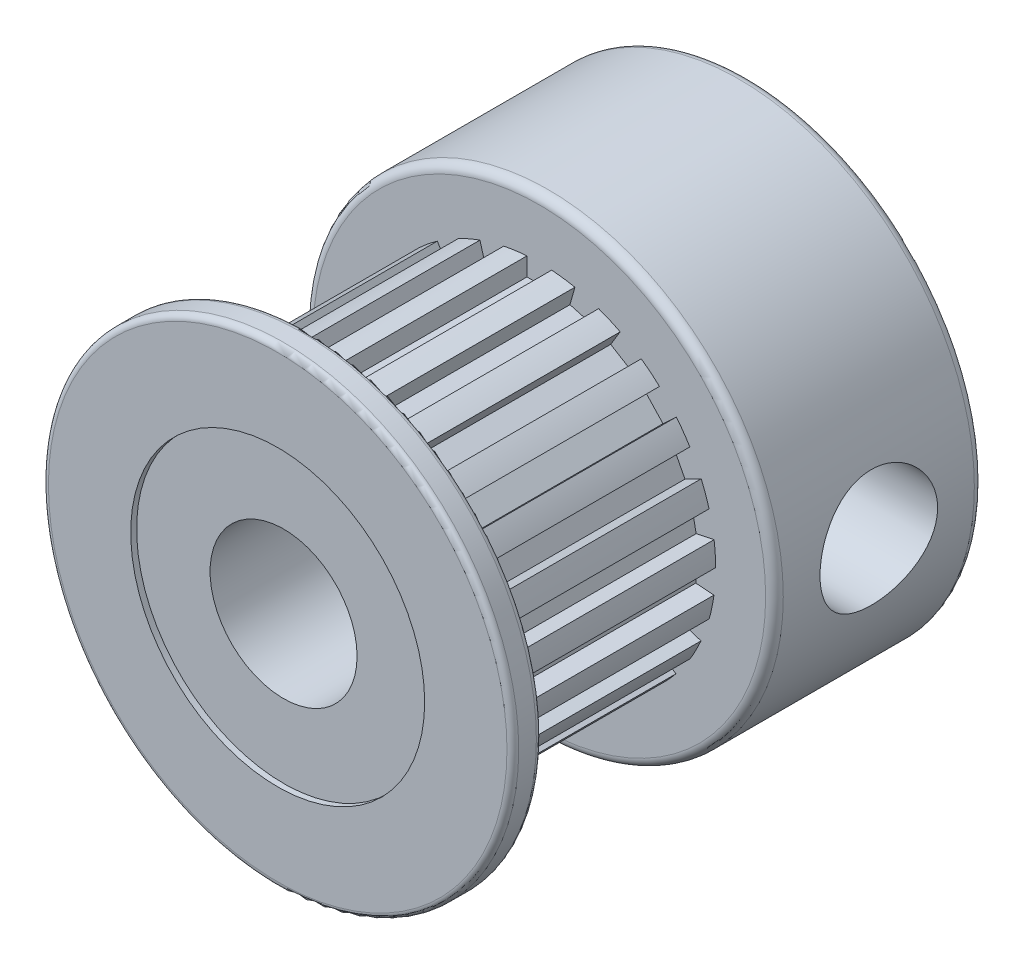
from build123d import *

# Parameters (mm, degrees)
SKETCH_1_R               = 8
EXTRUDE_1_DEPTH          = 7.1
SKETCH_2_R               = 6
EXTRUDE_2_DEPTH          = 7.9
SKETCH_3_R               = 8
EXTRUDE_3_DEPTH          = 1
SKETCH_4_W               = 0.839391048
SKETCH_4_H               = 1.04923881
CUT_EXTRUDE_1_DEPTH      = 7.9
SKETCH_5_R               = 2.5
CUT_EXTRUDE_2_DEPTH      = 21
CUT_EXTRUDE_3_REACH      = 26
CUT_EXTRUDE_3_END_RADIUS = 2.5
SKETCH_6_R               = 2
CUT_EXTRUDE_4_REACH      = 26
CUT_EXTRUDE_4_END_RADIUS = 2.5
SKETCH_7_R               = 2
SKETCH_8_R               = 5
CUT_EXTRUDE_5_DEPTH      = 0.2
FILLET_1_R               = 0.2
FILLET_2_R               = 0.3


with BuildPart() as part:
    # 草图1 → 凸台-拉伸1 (new body)
    with BuildSketch(Plane.XY):
        Circle(SKETCH_1_R)
    extrude(amount=EXTRUDE_1_DEPTH)

    # 草图2 → 凸台-拉伸2 (add)
    with BuildSketch(Plane.XY.offset(7.1)):
        Circle(SKETCH_2_R)
    extrude(amount=EXTRUDE_2_DEPTH)

    # 草图3 → 凸台-拉伸3 (add)
    with BuildSketch(Plane.XY.offset(15)):
        Circle(SKETCH_3_R)
    extrude(amount=EXTRUDE_3_DEPTH)

    # 草图4 → 切除-拉伸1 (cut)
    with BuildSketch(Plane.XY.offset(7.1)):
        Polygon((1.326202023, 6.288875776), (1.04312078, 5.278545587), (1.851384931, 5.052080593), (2.134466174, 6.062410781), align=None)
        with Locations((0, 5.888852821)):
            Rectangle(SKETCH_4_W, SKETCH_4_H)
        Polygon((2.973741233, 5.697862179), (2.428573588, 4.80137218), (3.145765587, 4.365238063), (3.690933233, 5.261728063), align=None)
        Polygon((4.40073166, 4.68426421), (3.633910202, 3.968102962), (4.206839201, 3.354645796), (4.973660658, 4.070807044), align=None)
        Polygon((5.501339951, 3.323255794), (4.569736321, 2.840537701), (4.955910795, 2.095254797), (5.887514425, 2.57797289), align=None)
        Polygon((6.193939026, 1.715776698), (5.166646002, 1.502302753), (5.337425159, 0.680468335), (6.364718182, 0.89394228), align=None)
        Polygon((6.427161978, -0.018953706), (5.380369186, 0.052648883), (5.323087115, -0.784785351), (6.369879907, -0.85638794), align=None)
        Polygon((6.183711728, -1.7522784), (5.195055, -1.400909715), (4.913960051, -2.191835098), (5.90261678, -2.543203783), align=None)
        Polygon((5.481643869, -3.355644622), (4.62444735, -2.750569247), (4.14038705, -3.436326462), (4.997583569, -4.041401837), align=None)
        Polygon((4.37302756, -4.710138033), (3.710865596, -3.896231641), (3.059740483, -4.425961212), (3.721902447, -5.239867604), align=None)
        Polygon((2.940083802, -5.715302054), (2.522065917, -4.752928359), (1.752166961, -5.087342668), (2.170184847, -6.049716362), align=None)
        Polygon((1.289087479, -6.296588267), (1.146216147, -5.257122124), (0.314643232, -5.37141919), (0.457514565, -6.410885333), align=None)
        Polygon((-0.457514565, -6.410885333), (-0.314643232, -5.37141919), (-1.146216147, -5.257122124), (-1.289087479, -6.296588267), align=None)
        Polygon((-2.170184847, -6.049716362), (-1.752166961, -5.087342668), (-2.522065917, -4.752928359), (-2.940083802, -5.715302054), align=None)
        Polygon((-3.721902447, -5.239867604), (-3.059740483, -4.425961212), (-3.710865596, -3.896231641), (-4.37302756, -4.710138033), align=None)
        Polygon((-4.997583569, -4.041401837), (-4.14038705, -3.436326462), (-4.62444735, -2.750569247), (-5.481643869, -3.355644622), align=None)
        Polygon((-5.90261678, -2.543203783), (-4.913960051, -2.191835098), (-5.195055, -1.400909715), (-6.183711728, -1.7522784), align=None)
        Polygon((-6.369879907, -0.85638794), (-5.323087115, -0.784785351), (-5.380369186, 0.052648883), (-6.427161978, -0.018953706), align=None)
        Polygon((-6.364718182, 0.89394228), (-5.337425159, 0.680468335), (-5.166646002, 1.502302753), (-6.193939026, 1.715776698), align=None)
        Polygon((-5.887514425, 2.57797289), (-4.955910795, 2.095254797), (-4.569736321, 2.840537701), (-5.501339951, 3.323255794), align=None)
        Polygon((-4.973660658, 4.070807044), (-4.206839201, 3.354645796), (-3.633910202, 3.968102962), (-4.40073166, 4.68426421), align=None)
        Polygon((-3.690933233, 5.261728063), (-3.145765587, 4.365238063), (-2.428573588, 4.80137218), (-2.973741233, 5.697862179), align=None)
        Polygon((-2.134466174, 6.062410781), (-1.851384931, 5.052080593), (-1.04312078, 5.278545587), (-1.326202023, 6.288875776), align=None)
    extrude(amount=CUT_EXTRUDE_1_DEPTH, mode=Mode.SUBTRACT)

    # 草图5 → 切除-拉伸2 (cut)
    with BuildSketch(Plane.XY.offset(16)):
        Circle(SKETCH_5_R)
    extrude(amount=-CUT_EXTRUDE_2_DEPTH, mode=Mode.SUBTRACT)

    # 切除-拉伸3: up to this cylinder (the profile starts outside it)
    cut_extrude_3_end = Plane(origin=(0, 0, 3.55), z_dir=(0, 0, 1)) * Cylinder(CUT_EXTRUDE_3_END_RADIUS, 58, mode=Mode.PRIVATE)
    # 草图6 → 切除-拉伸3 (cut, up to the surface)
    with BuildSketch(Plane(origin=(8, 0, 0), x_dir=(0, 0, -1), z_dir=(1, 0, 0)), mode=Mode.PRIVATE) as cut_extrude_3_sk1:
        with Locations((-3.55, 0)):
            Circle(SKETCH_6_R)
    cut_extrude_3_tool1 = extrude(cut_extrude_3_sk1.sketch, amount=-CUT_EXTRUDE_3_REACH, mode=Mode.PRIVATE) - cut_extrude_3_end
    add(cut_extrude_3_tool1.solids().sort_by_distance((8, 0, 3.55))[0], mode=Mode.SUBTRACT)

    # 切除-拉伸4: up to this cylinder (the profile starts outside it)
    cut_extrude_4_end = Plane(origin=(0, 0, 3.55), z_dir=(0, 0, 1)) * Cylinder(CUT_EXTRUDE_4_END_RADIUS, 58, mode=Mode.PRIVATE)
    # 草图7 → 切除-拉伸4 (cut, up to the surface)
    with BuildSketch(Plane(origin=(0, -8, 0), x_dir=(-1, 0, 0), z_dir=(0, -1, 0)), mode=Mode.PRIVATE) as cut_extrude_4_sk1:
        with Locations(Location((0, -3.55, 0), (0, 0, 90))):
            Circle(SKETCH_7_R)
    cut_extrude_4_tool1 = extrude(cut_extrude_4_sk1.sketch, amount=-CUT_EXTRUDE_4_REACH, mode=Mode.PRIVATE) - cut_extrude_4_end
    add(cut_extrude_4_tool1.solids().sort_by_distance((0, -8, 3.55))[0], mode=Mode.SUBTRACT)

    # 草图8 → 切除-拉伸5 (cut)
    with BuildSketch(Plane.XY.offset(16)):
        Circle(SKETCH_8_R)
    extrude(amount=-CUT_EXTRUDE_5_DEPTH, mode=Mode.SUBTRACT)

    # 圆角1
    fillet_1_edges = [part.edges().sort_by_distance(p)[0] for p in [
        (-8, 0, 16),
        (-8, 0, 15),
    ]]
    fillet(fillet_1_edges, radius=FILLET_1_R)

    # 圆角2
    fillet_2_edges = [part.edges().sort_by_distance(p)[0] for p in [
        (-8, 0, 0),
        (-8, 0, 7.1),
    ]]
    fillet(fillet_2_edges, radius=FILLET_2_R)


solid = part.part
